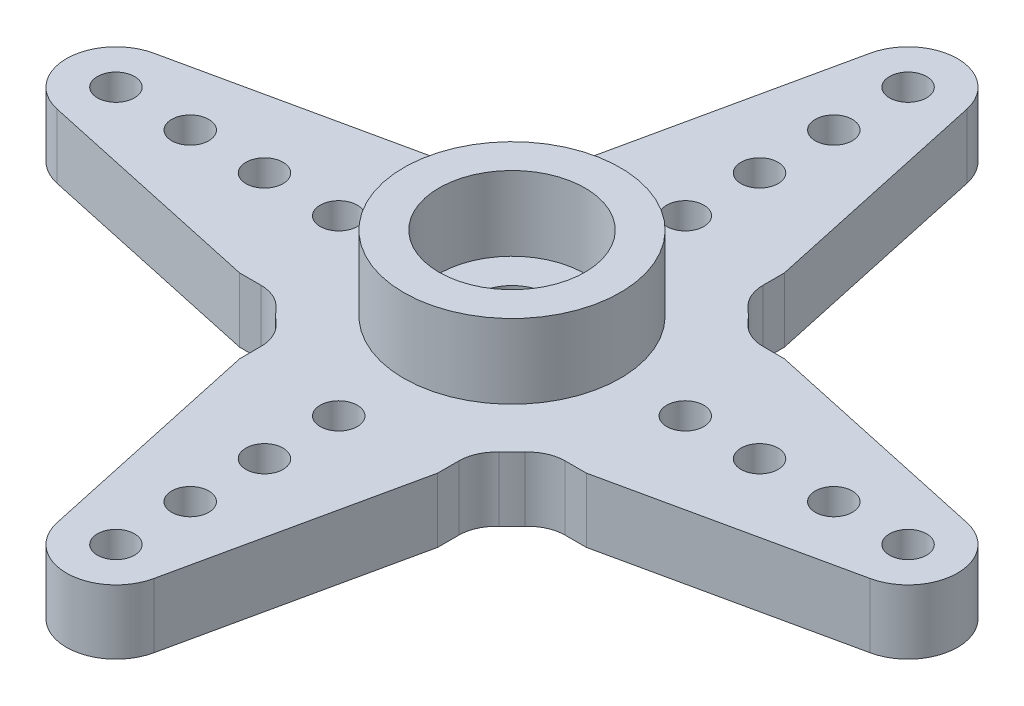
from build123d import *

# Parameters (mm, degrees)
CROQUIS1_R              = 0.75
CROQUIS1_R_2            = 1.5
SALIENTE_EXTRUIR1_DEPTH = 2.6
CROQUIS2_R              = 4.375
CROQUIS2_R_2            = 2.95
SALIENTE_EXTRUIR2_DEPTH = 3


with BuildPart() as part:
    # Croquis1 → Saliente-Extruir1 (new body)
    with BuildSketch(Plane(origin=(0, 0, 0), x_dir=(1, 0, 0), z_dir=(0, 1, 0))):
        with BuildLine():
            Line((-4, 7), (-4, 6.149186938))
            ThreePointArc((-4, 6.149186938), (-4.130693606, 5.536814502), (-4.5, 5.031152949))
            ThreePointArc((-4.5, 5.031152949), (-4.638282144, 4.903961537), (-4.772970773, 4.772970773))
            ThreePointArc((-4.772970773, 4.772970773), (-4.903961537, 4.638282144), (-5.031152949, 4.5))
            ThreePointArc((-5.031152949, 4.5), (-5.536814502, 4.130693606), (-6.149186938, 4))
            Line((-6.149186938, 4), (-7, 4))
            Line((-7, 4), (-16.424218619, 1.954491894))
            ThreePointArc((-16.424218619, 1.954491894), (-18, 0), (-16.424218619, -1.954491894))
            Line((-16.424218619, -1.954491894), (-7, -4))
            Line((-7, -4), (-6.149186938, -4))
            ThreePointArc((-6.149186938, -4), (-5.536814502, -4.130693606), (-5.031152949, -4.5))
            ThreePointArc((-5.031152949, -4.5), (-4.903961537, -4.638282144), (-4.772970773, -4.772970773))
            ThreePointArc((-4.772970773, -4.772970773), (-4.638282144, -4.903961537), (-4.5, -5.031152949))
            ThreePointArc((-4.5, -5.031152949), (-4.130693606, -5.536814502), (-4, -6.149186938))
            Line((-4, -6.149186938), (-4, -7))
            Line((-4, -7), (-1.954491894, -16.424218619))
            ThreePointArc((-1.954491894, -16.424218619), (0, -18), (1.954491894, -16.424218619))
            Line((1.954491894, -16.424218619), (4, -7))
            Line((4, -7), (4, -6.149186938))
            ThreePointArc((4, -6.149186938), (4.130693606, -5.536814502), (4.5, -5.031152949))
            ThreePointArc((4.5, -5.031152949), (4.638282144, -4.903961537), (4.772970773, -4.772970773))
            ThreePointArc((4.772970773, -4.772970773), (4.903961537, -4.638282144), (5.031152949, -4.5))
            ThreePointArc((5.031152949, -4.5), (5.536814502, -4.130693606), (6.149186938, -4))
            Line((6.149186938, -4), (7, -4))
            Line((7, -4), (16.424218619, -1.954491894))
            ThreePointArc((16.424218619, -1.954491894), (18, 0), (16.424218619, 1.954491894))
            Line((16.424218619, 1.954491894), (7, 4))
            Line((7, 4), (6.149186938, 4))
            ThreePointArc((6.149186938, 4), (5.536814502, 4.130693606), (5.031152949, 4.5))
            ThreePointArc((5.031152949, 4.5), (4.903961537, 4.638282144), (4.772970773, 4.772970773))
            ThreePointArc((4.772970773, 4.772970773), (4.638282144, 4.903961537), (4.5, 5.031152949))
            ThreePointArc((4.5, 5.031152949), (4.130693606, 5.536814502), (4, 6.149186938))
            Line((4, 6.149186938), (4, 7))
            Line((4, 7), (1.954491894, 16.424218619))
            ThreePointArc((1.954491894, 16.424218619), (0, 18), (-1.954491894, 16.424218619))
            Line((-1.954491894, 16.424218619), (-4, 7))
        make_face()
        with Locations(Location((0, 16, 0), (0, 0, 270))):
            Circle(CROQUIS1_R, mode=Mode.SUBTRACT)
        with Locations(Location((0, 13, 0), (0, 0, 270))):
            Circle(CROQUIS1_R, mode=Mode.SUBTRACT)
        with Locations(Location((0, 10, 0), (0, 0, 270))):
            Circle(CROQUIS1_R, mode=Mode.SUBTRACT)
        with Locations(Location((0, 7, 0), (0, 0, 270))):
            Circle(CROQUIS1_R, mode=Mode.SUBTRACT)
        with Locations(Location((16, 0, 0), (0, 0, 270))):
            Circle(CROQUIS1_R, mode=Mode.SUBTRACT)
        with Locations(Location((13, 0, 0), (0, 0, 270))):
            Circle(CROQUIS1_R, mode=Mode.SUBTRACT)
        with Locations(Location((10, 0, 0), (0, 0, 270))):
            Circle(CROQUIS1_R, mode=Mode.SUBTRACT)
        with Locations(Location((7, 0, 0), (0, 0, 270))):
            Circle(CROQUIS1_R, mode=Mode.SUBTRACT)
        with Locations(Location((0, -16, 0), (0, 0, 270))):
            Circle(CROQUIS1_R, mode=Mode.SUBTRACT)
        with Locations(Location((0, -13, 0), (0, 0, 270))):
            Circle(CROQUIS1_R, mode=Mode.SUBTRACT)
        with Locations(Location((0, -10, 0), (0, 0, 270))):
            Circle(CROQUIS1_R, mode=Mode.SUBTRACT)
        with Locations(Location((0, -7, 0), (0, 0, 270))):
            Circle(CROQUIS1_R, mode=Mode.SUBTRACT)
        with Locations(Location((-16, 0, 0), (0, 0, 270))):
            Circle(CROQUIS1_R, mode=Mode.SUBTRACT)
        with Locations(Location((-13, 0, 0), (0, 0, 270))):
            Circle(CROQUIS1_R, mode=Mode.SUBTRACT)
        with Locations(Location((-10, 0, 0), (0, 0, 270))):
            Circle(CROQUIS1_R, mode=Mode.SUBTRACT)
        with Locations(Location((-7, 0, 0), (0, 0, 270))):
            Circle(CROQUIS1_R, mode=Mode.SUBTRACT)
        with Locations(Location((0, 0, 0), (0, 0, 270))):
            Circle(CROQUIS1_R_2, mode=Mode.SUBTRACT)
    extrude(amount=SALIENTE_EXTRUIR1_DEPTH)

    # Croquis2 → Saliente-Extruir2 (add)
    with BuildSketch(Plane(origin=(0, 2.6, 0), x_dir=(1, 0, 0), z_dir=(0, 1, 0))):
        with Locations(Location((0, 0, 0), (0, 0, 270))):
            Circle(CROQUIS2_R)
        with Locations(Location((0, 0, 0), (0, 0, 270))):
            Circle(CROQUIS2_R_2, mode=Mode.SUBTRACT)
    extrude(amount=SALIENTE_EXTRUIR2_DEPTH)


solid = part.part
